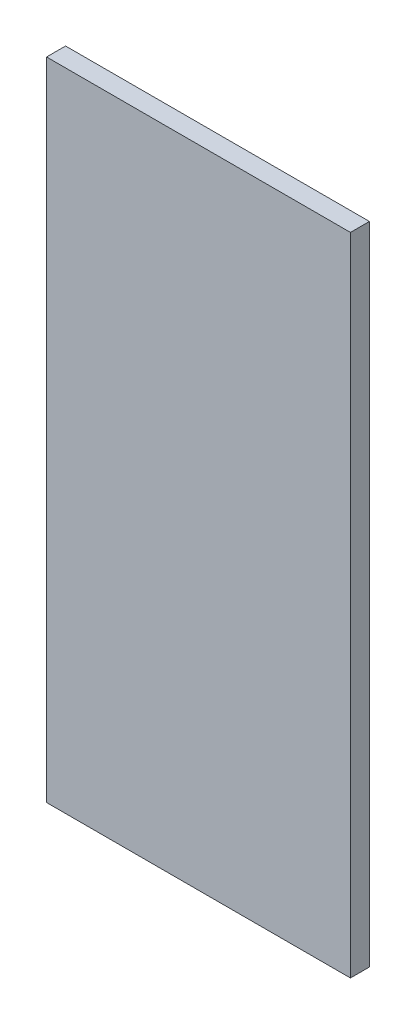
from build123d import *

# Parameters (mm, degrees)
CROQUIS1_W              = 40
CROQUIS1_H              = 85
SALIENTE_EXTRUIR1_DEPTH = 2.5


with BuildPart() as part:
    # Croquis1 → Saliente-Extruir1 (new body)
    with BuildSketch(Plane.XY):
        Rectangle(CROQUIS1_W, CROQUIS1_H)
    extrude(amount=SALIENTE_EXTRUIR1_DEPTH)


solid = part.part
